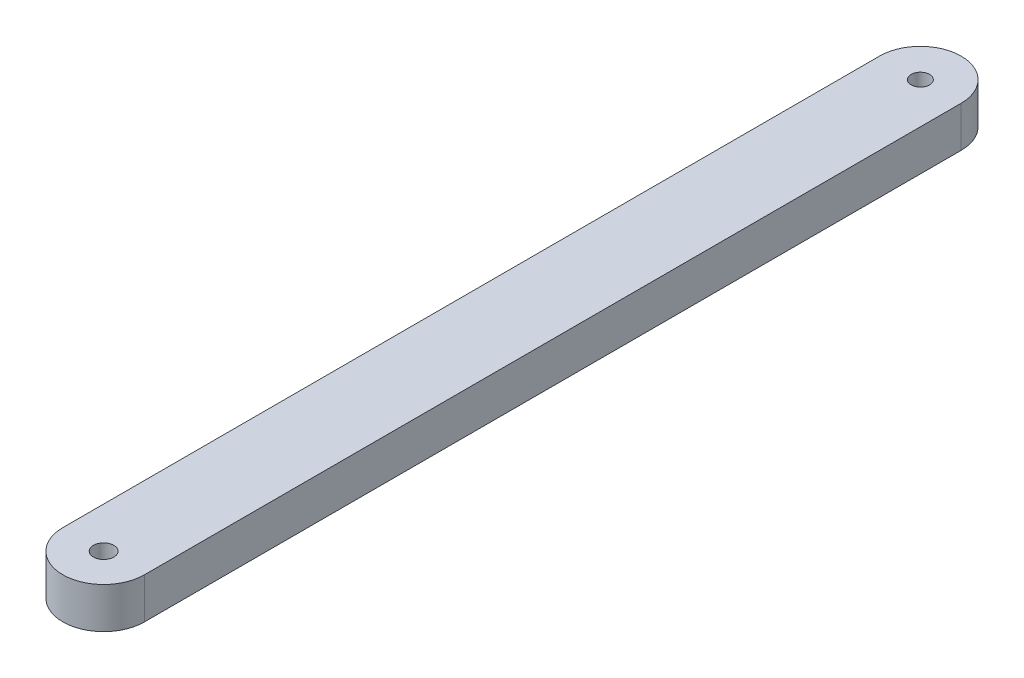
from build123d import *

# Parameters (mm, degrees)
SKETCH1_R           = 2.24506403
SKETCH1_R_2         = 2.5
BOSS_EXTRUDE1_DEPTH = 10


with BuildPart() as part:
    # Sketch1 → Boss-Extrude1 (new body)
    with BuildSketch(Plane(origin=(0, 0, 0), x_dir=(1, 0, 0), z_dir=(0, 1, 0))):
        with BuildLine():
            ThreePointArc((10, -100), (0, -110), (-10, -100))
            Line((-10, -100), (-10, 100))
            ThreePointArc((-10, 100), (0, 110), (10, 100))
            Line((10, 100), (10, -100))
        make_face()
        with Locations(Location((0, 100, 0), (0, 0, 270))):
            Circle(SKETCH1_R, mode=Mode.SUBTRACT)
        with Locations(Location((0, -100, 0), (0, 0, 270))):
            Circle(SKETCH1_R_2, mode=Mode.SUBTRACT)
    extrude(amount=BOSS_EXTRUDE1_DEPTH)


solid = part.part
